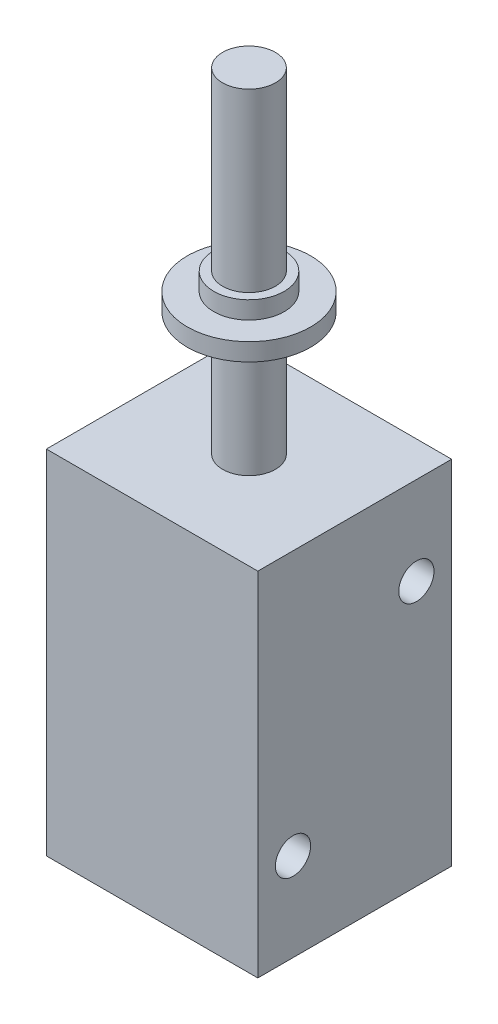
from build123d import *

# Parameters (mm, degrees)
SKETCH1_W           = 12
SKETCH1_H           = 11
BOSS_EXTRUDE1_DEPTH = 20
SKETCH2_R           = 1.5
BOSS_EXTRUDE2_DEPTH = 19
SKETCH3_R           = 3.5
BOSS_EXTRUDE3_DEPTH = 1
SKETCH4_R           = 2
BOSS_EXTRUDE4_DEPTH = 1
SKETCH5_R           = 1
CUT_EXTRUDE1_DEPTH  = 12


with BuildPart() as part:
    # Sketch1 → Boss-Extrude1 (new body)
    with BuildSketch(Plane(origin=(0, 0, 0), x_dir=(1, 0, 0), z_dir=(0, 1, 0))):
        with Locations((6, 5.5)):
            Rectangle(SKETCH1_W, SKETCH1_H)
    extrude(amount=BOSS_EXTRUDE1_DEPTH)

    # Sketch2 → Boss-Extrude2 (add)
    with BuildSketch(Plane(origin=(0, 20, 0), x_dir=(1, 0, 0), z_dir=(0, 1, 0))):
        with Locations(Location((6, 5.5, 0), (0, 0, 270))):
            Circle(SKETCH2_R)
    extrude(amount=BOSS_EXTRUDE2_DEPTH)

    # Sketch3 → Boss-Extrude3 (add)
    with BuildSketch(Plane(origin=(0, 27, 0), x_dir=(1, 0, 0), z_dir=(0, 1, 0))):
        with Locations(Location((6, 5.5, 0), (0, 0, 270))):
            Circle(SKETCH3_R)
    extrude(amount=BOSS_EXTRUDE3_DEPTH)

    # Sketch4 → Boss-Extrude4 (add)
    with BuildSketch(Plane(origin=(0, 28, 0), x_dir=(1, 0, 0), z_dir=(0, 1, 0))):
        with Locations(Location((6, 5.5, 0), (0, 0, 270))):
            Circle(SKETCH4_R)
    extrude(amount=BOSS_EXTRUDE4_DEPTH)

    # Sketch5 → Cut-Extrude1 (cut)
    with BuildSketch(Plane(origin=(12, 0, 0), x_dir=(0, 0, -1), z_dir=(1, 0, 0))):
        with Locations((2, 5)):
            Circle(SKETCH5_R)
        with Locations((9, 15)):
            Circle(SKETCH5_R)
    extrude(amount=-CUT_EXTRUDE1_DEPTH, mode=Mode.SUBTRACT)


solid = part.part
